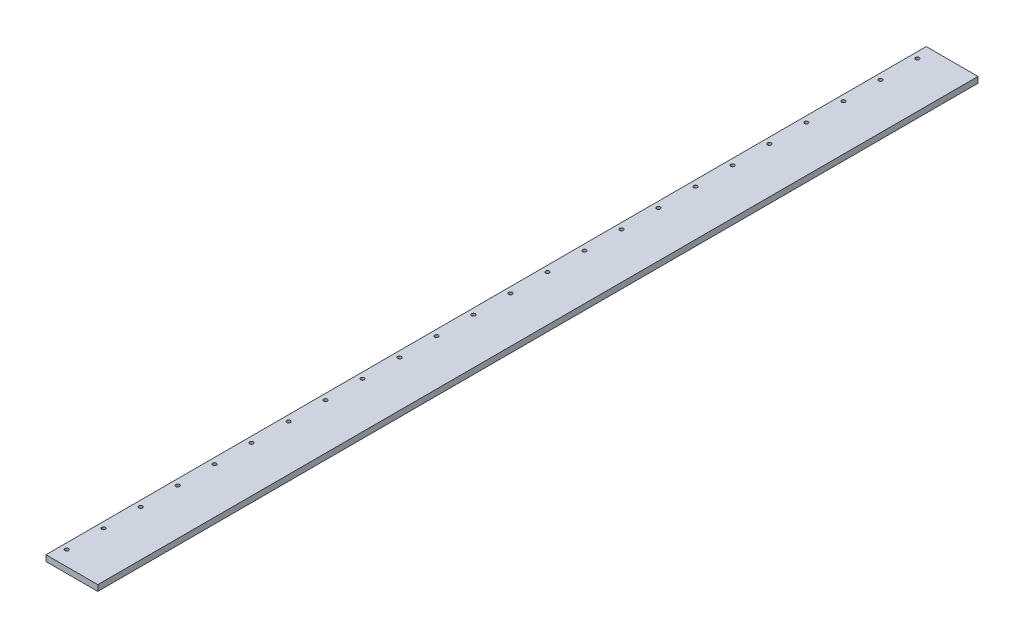
from build123d import *

# Parameters (mm, degrees)
SKETCH1_W           = 35
SKETCH1_H           = 4
BOSS_EXTRUDE1_DEPTH = 595
M3_TAPPED_HOLE1_D   = 2.5
LPATTERN1_COUNT     = 24
LPATTERN1_PITCH     = 25


with BuildPart() as part:
    # Sketch1 → Boss-Extrude1 (new body)
    with BuildSketch(Plane.XY):
        with Locations((1, 0)):
            Rectangle(SKETCH1_W, SKETCH1_H)
    extrude(amount=BOSS_EXTRUDE1_DEPTH)

    # M3 Tapped Hole1 (through all)
    with Locations(Plane(origin=(-12.5, 2, 10), x_dir=(0, 0, 1), z_dir=(0, 1, 0))):
        with Locations((0, 0)):
            m3_tapped_hole1 = Hole(M3_TAPPED_HOLE1_D / 2)

    # LPattern1: M3 Tapped Hole1 ×24
    with Locations(*[(0, 0, i * LPATTERN1_PITCH) for i in range(1, LPATTERN1_COUNT)]):
        add(m3_tapped_hole1, mode=Mode.SUBTRACT)


solid = part.part
